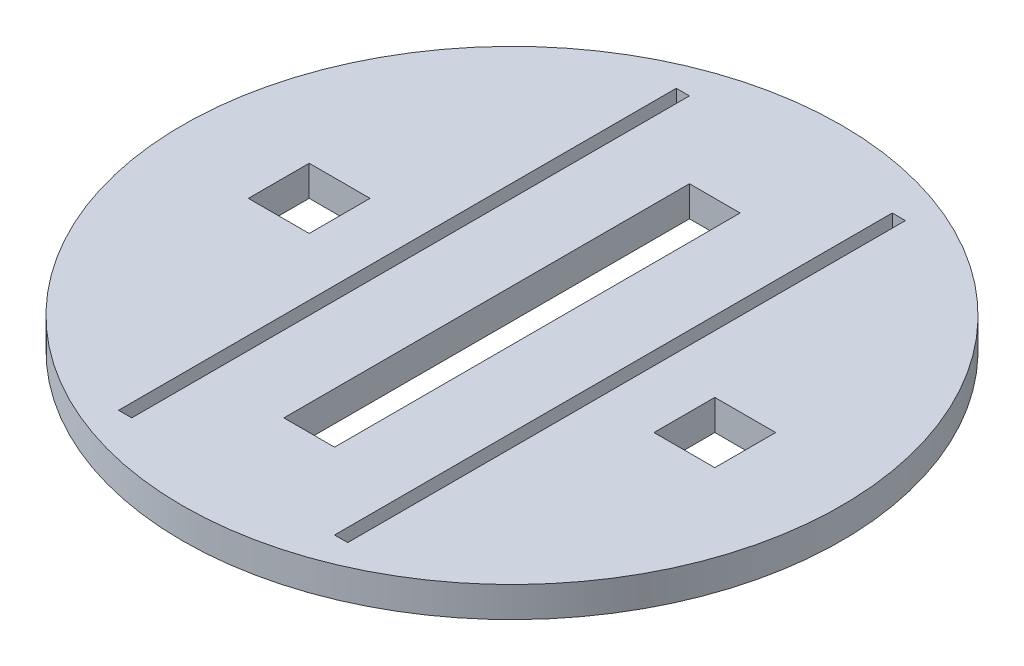
from build123d import *

# Parameters (mm, degrees)
SKETCH1_R               = 32.5
BOSS_EXTRUDE1_DEPTH     = 3
CUT_EXTRUDE1_DEPTH      = 27.5
CUT_EXTRUDE1_DEPTH_BACK = 27.5
SKETCH2_W               = 1.3
SKETCH2_H               = 6.728638504
SKETCH3_W               = 6
SKETCH3_H               = 6
CUT_EXTRUDE2_DEPTH      = 10
SKETCH4_W               = 5
SKETCH4_H               = 40
CUT_EXTRUDE3_DEPTH      = 10


with BuildPart() as part:
    # Sketch1 → Boss-Extrude1 (new body)
    with BuildSketch(Plane(origin=(0, 0, 0), x_dir=(1, 0, 0), z_dir=(0, 1, 0))):
        Circle(SKETCH1_R)
    extrude(amount=BOSS_EXTRUDE1_DEPTH)

    # Sketch2 → Cut-Extrude1 (cut, two sides: drawn at the far end of the back side and taken through both)
    with BuildSketch(Plane.XY.offset(-CUT_EXTRUDE1_DEPTH_BACK)):
        with Locations((-10.65, 0)):
            Rectangle(SKETCH2_W, SKETCH2_H)
        with Locations((10.65, 0)):
            Rectangle(SKETCH2_W, SKETCH2_H)
    extrude(amount=CUT_EXTRUDE1_DEPTH + CUT_EXTRUDE1_DEPTH_BACK, mode=Mode.SUBTRACT)

    # Sketch3 → Cut-Extrude2 (cut)
    with BuildSketch(Plane(origin=(0, 0, 0), x_dir=(1, 0, 0), z_dir=(0, 1, 0))):
        with Locations((-20, 0)):
            Rectangle(SKETCH3_W, SKETCH3_H)
        with Locations((20, 0)):
            Rectangle(SKETCH3_W, SKETCH3_H)
    extrude(amount=CUT_EXTRUDE2_DEPTH, mode=Mode.SUBTRACT)

    # Sketch4 → Cut-Extrude3 (cut)
    with BuildSketch(Plane.XZ):
        Rectangle(SKETCH4_W, SKETCH4_H)
    extrude(amount=-CUT_EXTRUDE3_DEPTH, mode=Mode.SUBTRACT)


solid = part.part
